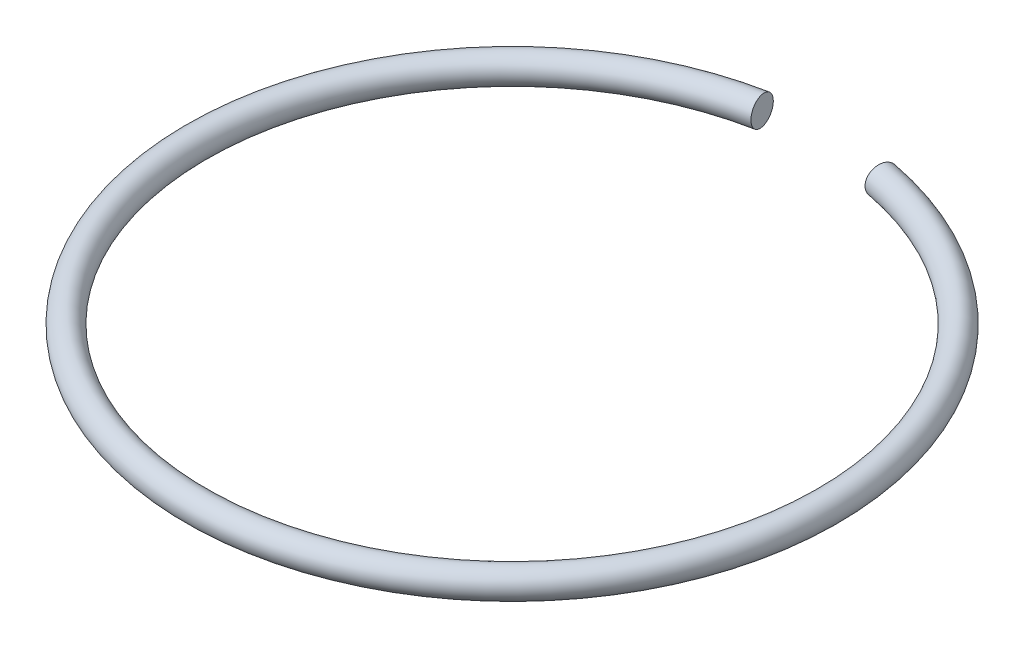
from build123d import *

# Parameters (mm, degrees)
ESBO_O1_R                  = 1.5
CORTE_EXTRUS_O1_DEPTH      = 50.520198044
CORTE_EXTRUS_O1_DEPTH_BACK = 50.520198044


with BuildPart() as part:
    # Esboço1 → Revolução1 (revolve)
    with BuildSketch(Plane.XY, mode=Mode.PRIVATE) as revolu_o1_sk:
        with Locations((-33.5, 0)):
            Circle(ESBO_O1_R)
    revolve(revolu_o1_sk.sketch.rotate(Axis((0, 0, 0), (0, 1, 0)), 270), axis=Axis((0, 0, 0), (0, 1, 0)))

    # Esboço2 → Corte-extrusão1 (cut, two sides: drawn at the far end of the back side and taken through both)
    with BuildSketch(Plane(origin=(0, 0, 0), x_dir=(1, 0, 0), z_dir=(0, 1, 0)).offset(-CORTE_EXTRUS_O1_DEPTH_BACK)):
        Polygon((-6.75, 35), (6.75, 35), (0, 0), align=None)
    extrude(amount=CORTE_EXTRUS_O1_DEPTH + CORTE_EXTRUS_O1_DEPTH_BACK, mode=Mode.SUBTRACT)


solid = part.part
